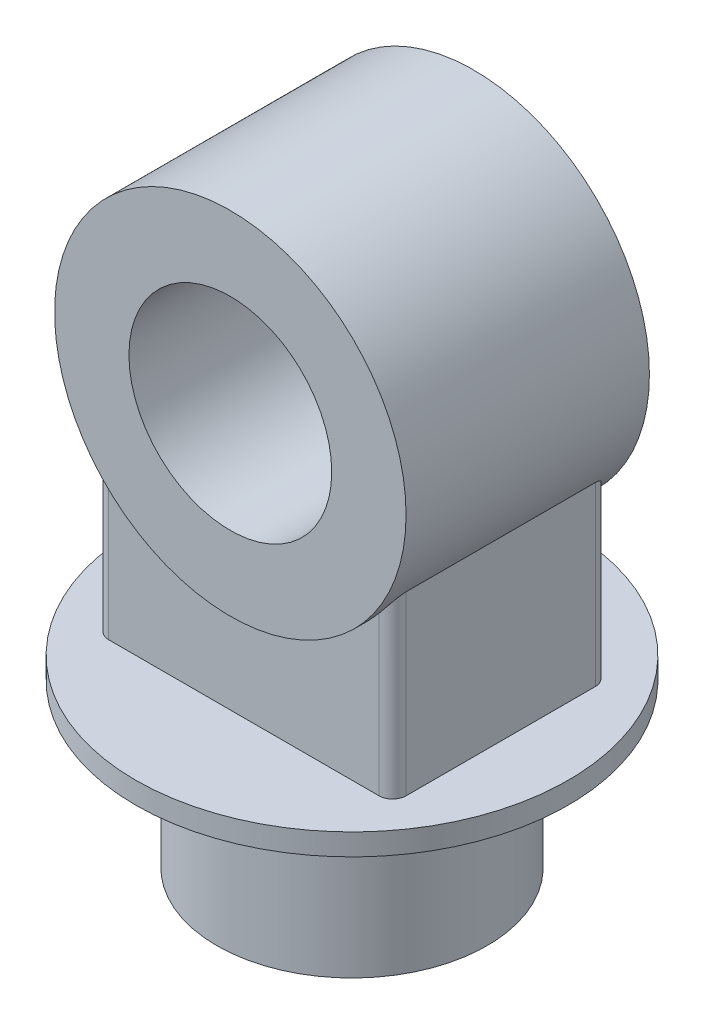
from build123d import *

# Parameters (mm, degrees)
CROQUIS1_R                   = 100
SALIENTE_EXTRUIR1_DEPTH      = 120
CROQUIS2_R                   = 160
SALIENTE_EXTRUIR2_DEPTH      = 16
CROQUIS4_R                   = 130
CROQUIS4_R_2                 = 75
SALIENTE_EXTRUIR3_DEPTH      = 90
SALIENTE_EXTRUIR4_REACH      = 402.125
SALIENTE_EXTRUIR4_END_RADIUS = 130
CROQUIS6_W                   = 220
CROQUIS6_H                   = 160
REDONDEO1_R                  = 10


with BuildPart() as part:
    # Croquis1 → Saliente-Extruir1 (new body)
    with BuildSketch(Plane(origin=(0, 0, 0), x_dir=(1, 0, 0), z_dir=(0, 1, 0))):
        with Locations(Location((0, 0, 0), (0, 0, 270))):
            Circle(CROQUIS1_R)
    extrude(amount=SALIENTE_EXTRUIR1_DEPTH)

    # Croquis2 → Saliente-Extruir2 (add)
    with BuildSketch(Plane(origin=(0, 120, 0), x_dir=(1, 0, 0), z_dir=(0, 1, 0))):
        with Locations(Location((0, 0, 0), (0, 0, 270))):
            Circle(CROQUIS2_R)
    extrude(amount=SALIENTE_EXTRUIR2_DEPTH)



with BuildPart() as body_2:
    # Croquis4 → Saliente-Extruir3 (new, symmetric)
    with BuildSketch(Plane.XY):
        with Locations(Location((0, 336, 0), (0, 0, 180))):
            Circle(CROQUIS4_R)
        with Locations(Location((0, 336, 0), (0, 0, 180))):
            Circle(CROQUIS4_R_2, mode=Mode.SUBTRACT)
    extrude(amount=SALIENTE_EXTRUIR3_DEPTH, both=True)


with BuildPart() as part_1:
    add(part.part)

    add(body_2.part)  # Saliente-Extruir4 merges body 2
    # Saliente-Extruir4: up to this cylinder (the profile starts outside it)
    saliente_extruir4_end = Plane(origin=(0, 336, 0), z_dir=(0, 0, -1)) * Cylinder(SALIENTE_EXTRUIR4_END_RADIUS, 1065.25, mode=Mode.PRIVATE)
    # Croquis6 → Saliente-Extruir4 (add, up to the surface)
    with BuildSketch(Plane(origin=(0, 136, 0), x_dir=(1, 0, 0), z_dir=(0, 1, 0)), mode=Mode.PRIVATE) as saliente_extruir4_sk1:
        Rectangle(CROQUIS6_W, CROQUIS6_H)
    saliente_extruir4_tool1 = extrude(saliente_extruir4_sk1.sketch, amount=SALIENTE_EXTRUIR4_REACH, mode=Mode.PRIVATE) - saliente_extruir4_end
    add(saliente_extruir4_tool1.solids().sort_by_distance((0, 136, 0))[0])

    # Redondeo1
    redondeo1_edges = [part_1.edges().sort_by_distance(p)[0] for p in [
        (110, 201.358983849, -80),
        (110, 201.358983849, 80),
        (-110, 201.358983849, -80),
        (-110, 201.358983849, 80),
    ]]
    fillet(redondeo1_edges, radius=REDONDEO1_R)


solid = part_1.part
